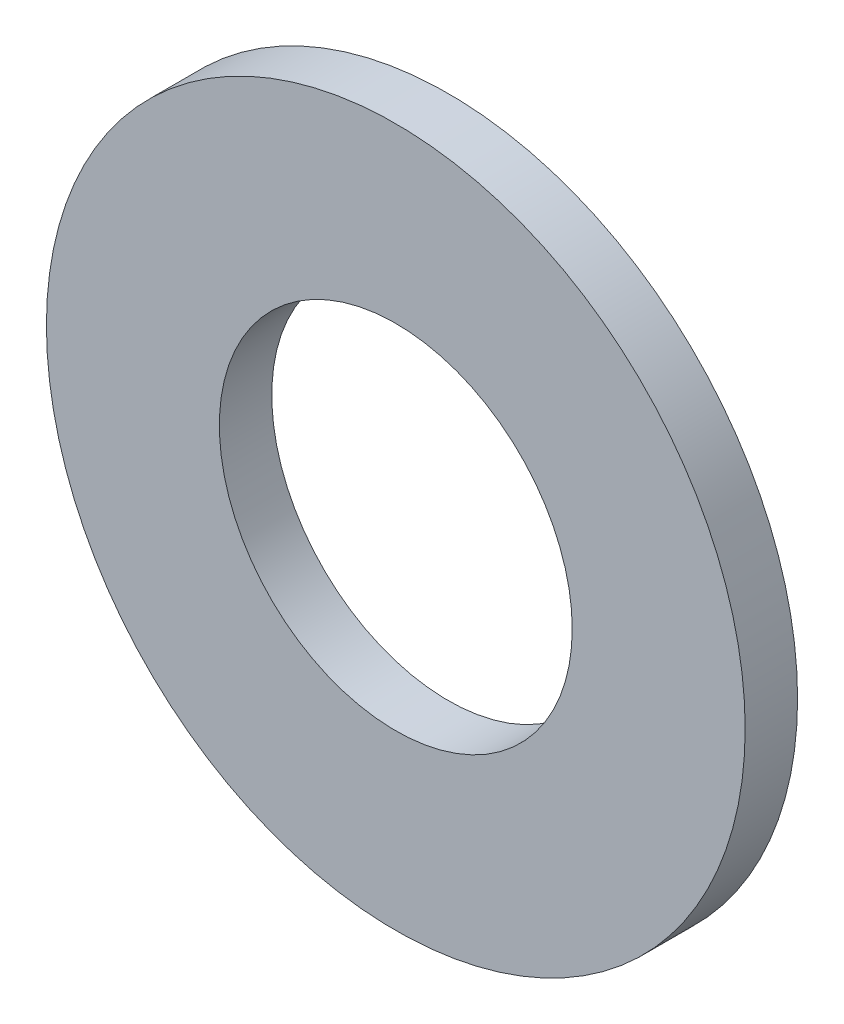
from build123d import *

# Parameters (mm, degrees)
SKETCH1_R           = 20
SKETCH1_R_2         = 10.1
BOSS_EXTRUDE1_DEPTH = 1.5


with BuildPart() as part:
    # Sketch1 → Boss-Extrude1 (new, symmetric)
    with BuildSketch(Plane.XY):
        Circle(SKETCH1_R)
        Circle(SKETCH1_R_2, mode=Mode.SUBTRACT)
    extrude(amount=BOSS_EXTRUDE1_DEPTH, both=True)


solid = part.part
